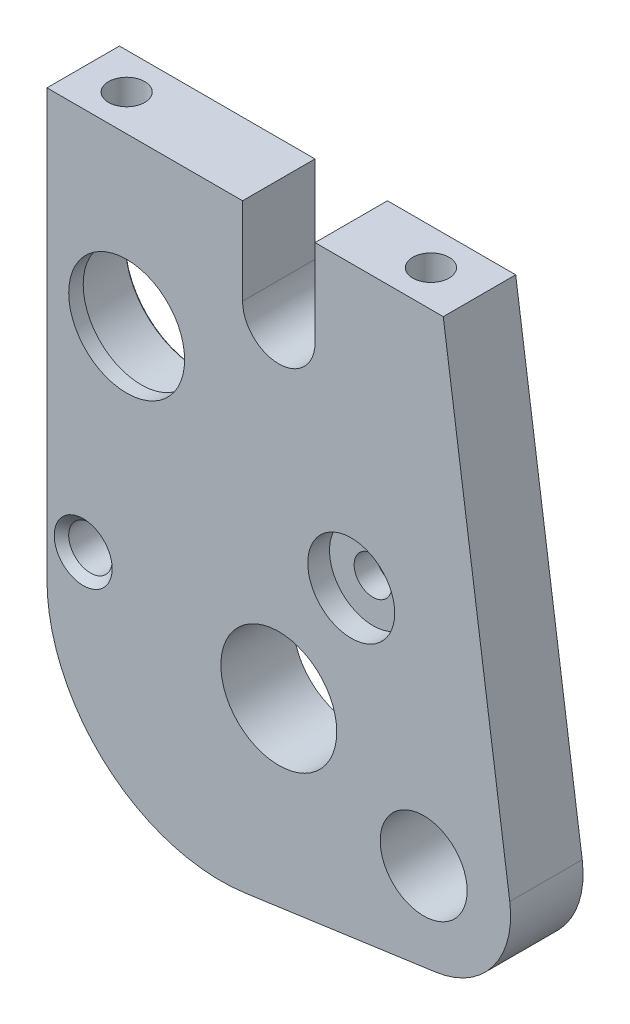
from build123d import *

# Parameters (mm, degrees)
SKETCH_1_W                = 34
SKETCH_1_H                = 39.5
EXTRUDE_1_DEPTH           = 5
FILLET_1_R                = 12
SKETCH_2_R                = 3
CUT_EXTRUDE_2_DEPTH       = 5
SKETCH_3_R                = 4
CUT_EXTRUDE_3_DEPTH       = 5
SKETCH_4_R                = 5
CUT_EXTRUDE_4_DEPTH       = 4
CUT_EXTRUDE_5_DEPTH       = 10
EXTRUDE1_START            = -5
EXTRUDE1_DEPTH            = 5
SKETCH_8_R                = 1.5
CUT_EXTRUDE_6_DEPTH       = 4.5
SKETCH9_R                 = 0.5
EXTRUDE5_DEPTH            = 53.525447848
CUT_EXTRUDE_7_DEPTH       = 0.5
SKETCH_13_R               = 4
CUT_EXTRUDE_8_DEPTH       = 10
SKETCH2_W                 = 6
SKETCH2_H                 = 7
EXTRUDE2_DEPTH            = 2
HOLE_WIZARD_1_D           = 2.6
HOLE_WIZARD_1_CBORE_D     = 6
HOLE_WIZARD_1_CBORE_DEPTH = 1.5
SKETCH7_R                 = 1.5
EXTRUDE3_DEPTH            = 2
EXTRUDE4_DEPTH            = 53.570644581
SKETCH10_R                = 1.5
EXTRUDE6_DEPTH            = 10
CHAMFER_5_SIZE            = 0.1
SKETCH_22_R               = 1.5
EXTRUDE_1_2_DEPTH         = 5
CHAMFER_6_SIZE            = 0.5
SKETCH_5_R                = 1.25
CUT_EXTRUDE_1_DEPTH       = 6


with BuildPart() as part:
    # 草图1 → Extrude 1 (new body)
    with BuildSketch(Plane.XY):
        with Locations((17, -19.75)):
            Rectangle(SKETCH_1_W, SKETCH_1_H)
    extrude(amount=EXTRUDE_1_DEPTH)

    # 圆角1
    fillet_1_edges = [part.edges().sort_by_distance(p)[0] for p in [
        (0, -39.5, 2.5),
    ]]
    fillet(fillet_1_edges, radius=FILLET_1_R)

    # 草图2 → 拉伸2 (cut)
    with BuildSketch(Plane.XY.offset(5)):
        with Locations((26, -33.5)):
            Circle(SKETCH_2_R)
    extrude(amount=-CUT_EXTRUDE_2_DEPTH, mode=Mode.SUBTRACT)

    # 草图3 → 拉伸3 (cut)
    with BuildSketch(Plane(origin=(0, 0, 0), x_dir=(-1, 0, 0), z_dir=(0, 0, -1))):
        with Locations((-5.5, -11.5)):
            Circle(SKETCH_3_R)
    extrude(amount=-CUT_EXTRUDE_3_DEPTH, mode=Mode.SUBTRACT)

    # 草图4 → 拉伸4 (cut)
    with BuildSketch(Plane(origin=(0, 0, 0), x_dir=(-1, 0, 0), z_dir=(0, 0, -1))):
        with Locations((-5.5, -11.5)):
            Circle(SKETCH_4_R)
    extrude(amount=-CUT_EXTRUDE_4_DEPTH, mode=Mode.SUBTRACT)

    # 草图7 → 拉伸5 (cut)
    with BuildSketch(Plane(origin=(0, 0, 0), x_dir=(-1, 0, 0), z_dir=(0, 0, -1))):
        with BuildLine():
            Line((-26, -39.5), (-34, -39.5))
            Line((-34, -39.5), (-34, 0))
            Line((-34, 0), (-27.350847473, 0))
            Line((-27.350847473, 0), (-31.941608412, -32.664961394))
            ThreePointArc((-31.941608412, -32.664961394), (-30.528257481, -37.436354174), (-26, -39.5))
        make_face()
    extrude(amount=-CUT_EXTRUDE_5_DEPTH, mode=Mode.SUBTRACT)

    # Sketch1 → Extrude1 (add)
    with BuildSketch(Plane.XY.offset(5).offset(EXTRUDE1_START)):
        with BuildLine():
            Line((26.835038606, -39.441608412), (13.670077212, -41.291823076))
            ThreePointArc((13.670077212, -41.291823076), (4.127291652, -38.465121213), (0, -29.408606251))
            Line((0, -29.408606251), (0, -26.519790857))
            Line((0, -26.519790857), (29.441458618, -38.414912266))
            ThreePointArc((29.441458618, -38.414912266), (28.19900736, -39.082505408), (26.835038606, -39.441608412))
        make_face()
    extrude(amount=EXTRUDE1_DEPTH)

    # 草图8 → 拉伸6 (cut)
    with BuildSketch(Plane.XY.offset(5)):
        with Locations((2.5, -26.5)):
            Circle(SKETCH_8_R)
    extrude(amount=-CUT_EXTRUDE_6_DEPTH, mode=Mode.SUBTRACT)

    # Sketch9 → Extrude5 (cut, through all)
    with BuildSketch(Plane.XY.offset(0.5)):
        with Locations((1.5, -26.5)):
            Circle(SKETCH9_R)
    extrude(amount=-EXTRUDE5_DEPTH, mode=Mode.SUBTRACT)

    # 草图9 → 拉伸7 (cut)
    with BuildSketch(Plane.XY.offset(5)):
        with BuildLine():
            Line((0.25, -26.5), (0.25, -22.5))
            ThreePointArc((0.25, -22.5), (2.5, -20.25), (4.75, -22.5))
            Line((4.75, -22.5), (4.75, -26.5))
            ThreePointArc((4.75, -26.5), (2.5, -28.75), (0.25, -26.5))
        make_face()
    extrude(amount=-CUT_EXTRUDE_7_DEPTH, mode=Mode.SUBTRACT)

    # 草图13 → 拉伸8 (cut)
    with BuildSketch(Plane.XY.offset(5)):
        with Locations((16, -28.5)):
            Circle(SKETCH_13_R)
    extrude(amount=-CUT_EXTRUDE_8_DEPTH, mode=Mode.SUBTRACT)

    # Sketch2 → Extrude2 (cut)
    with BuildSketch(Plane(origin=(0, 0, 0), x_dir=(-1, 0, 0), z_dir=(0, 0, -1))):
        with Locations((-21, -18.4)):
            Rectangle(SKETCH2_W, SKETCH2_H)
    extrude(amount=-EXTRUDE2_DEPTH, mode=Mode.SUBTRACT)

    # 打孔尺寸(%根据)内六角圆柱头螺钉的类型1 (through all)
    with Locations(Plane(origin=(21, -19.4, 5), x_dir=(1, 0, 0), z_dir=(0, 0, 1))):
        with Locations((0, 0)):
            CounterBoreHole(HOLE_WIZARD_1_D / 2, HOLE_WIZARD_1_CBORE_D / 2, HOLE_WIZARD_1_CBORE_DEPTH)

    # Sketch7 → Extrude3 (cut)
    with BuildSketch(Plane(origin=(0, 0, 0), x_dir=(-1, 0, 0), z_dir=(0, 0, -1))):
        with Locations((-24, -16.4)):
            Circle(SKETCH7_R)
        with Locations((-18, -16.4)):
            Circle(SKETCH7_R)
        with Locations((-24, -20.4)):
            Circle(SKETCH7_R)
        with Locations((-18, -20.4)):
            Circle(SKETCH7_R)
    extrude(amount=-EXTRUDE3_DEPTH, mode=Mode.SUBTRACT)

    # Sketch8 → Extrude4 (cut, through all)
    with BuildSketch(Plane(origin=(0, 0, 0), x_dir=(-1, 0, 0), z_dir=(0, 0, -1))):
        with BuildLine():
            Line((-13.5, -6), (-13.5, 0))
            Line((-13.5, 0), (-18.5, 0))
            Line((-18.5, 0), (-18.5, -6))
            ThreePointArc((-18.5, -6), (-16, -8.5), (-13.5, -6))
        make_face()
    extrude(amount=-EXTRUDE4_DEPTH, mode=Mode.SUBTRACT)

    # Sketch10 → Extrude6 (cut)
    with BuildSketch(Plane.XY.offset(4.5)):
        with Locations((2.5, -26.5)):
            Circle(SKETCH10_R)
    extrude(amount=-EXTRUDE6_DEPTH, mode=Mode.SUBTRACT)

    # 倒角5
    chamfer_5_edges = [part.edges().sort_by_distance(p)[0] for p in [
        (10.5, -11.5, 0),
    ]]
    chamfer(chamfer_5_edges, length=CHAMFER_5_SIZE)

    # 草图22 → Extrude 1 2 (add)
    with BuildSketch(Plane.XY.offset(5)):
        with BuildLine():
            Line((4.75, -26.5), (4.75, -22.5))
            ThreePointArc((4.75, -22.5), (2.5, -20.25), (0.25, -22.5))
            Line((0.25, -22.5), (0.25, -26.5))
            ThreePointArc((0.25, -26.5), (2.5, -28.75), (4.75, -26.5))
        make_face()
        with Locations((2.5, -26.5)):
            Circle(SKETCH_22_R, mode=Mode.SUBTRACT)
    extrude(amount=-EXTRUDE_1_2_DEPTH)

    # 倒角6
    chamfer_6_edges = [part.edges().sort_by_distance(p)[0] for p in [
        (1, -26.5, 5),
    ]]
    chamfer(chamfer_6_edges, length=CHAMFER_6_SIZE)

    # 草图5 → 切除-拉伸1 (cut)
    with BuildSketch(Plane(origin=(0, 0, 0), x_dir=(1, 0, 0), z_dir=(0, 1, 0))):
        with Locations(Location((24, -2.5, 0), (0, 0, 270))):
            Circle(SKETCH_5_R)
        with Locations(Location((3, -2.5, 0), (0, 0, 270))):
            Circle(SKETCH_5_R)
    extrude(amount=-CUT_EXTRUDE_1_DEPTH, mode=Mode.SUBTRACT)


solid = part.part
